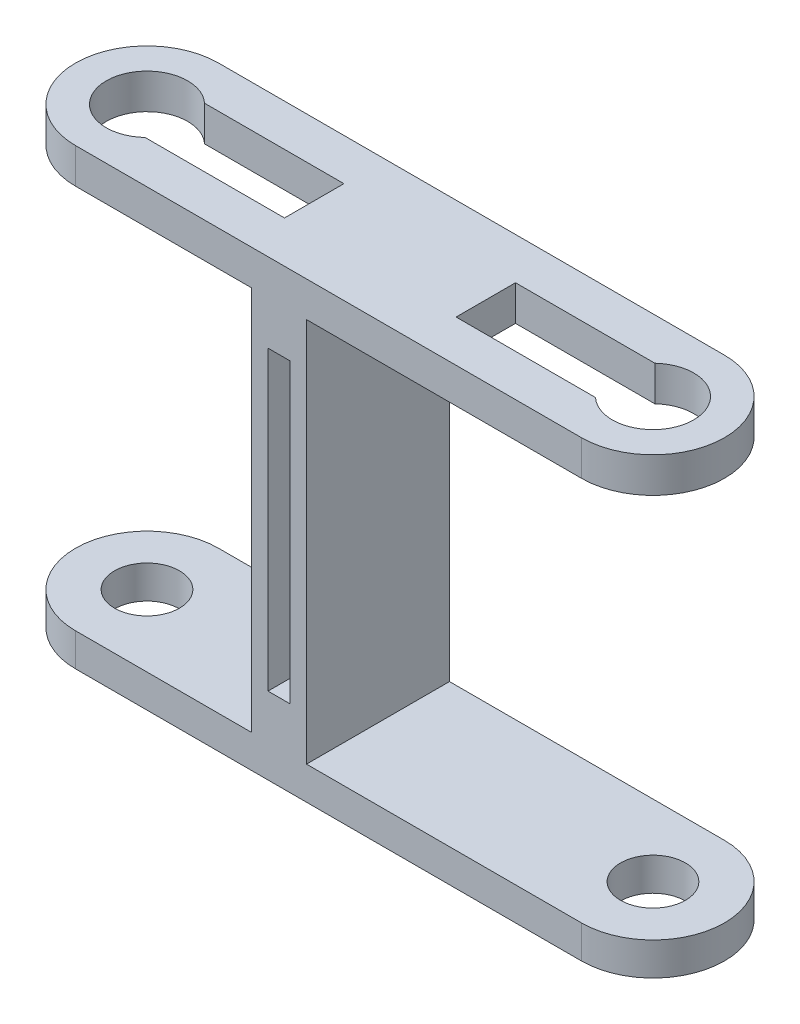
from build123d import *

# Parameters (mm, degrees)
BOSS_EXTRUDE1_START   = 43.1
SKETCH1_R             = 6.5
BOSS_EXTRUDE1_DEPTH   = 1.6
BOSS_EXTRUDE1_2_DEPTH = 1.6
BOSS_EXTRUDE2_START   = 43.1
SKETCH2_W             = 46
SKETCH2_H             = 13
BOSS_EXTRUDE2_DEPTH   = 1.6
CUT_EXTRUDE1_START    = 43.1
SKETCH3_R             = 3.7
CUT_EXTRUDE1_DEPTH    = 1.6
CUT_EXTRUDE2_START    = 43.1
SKETCH4_W             = 15.2
SKETCH4_H             = 5.4
CUT_EXTRUDE2_DEPTH    = 1.6
BOSS_EXTRUDE3_START   = 5
SKETCH5_R             = 6.5
BOSS_EXTRUDE3_DEPTH   = 1.5
BOSS_EXTRUDE3_2_DEPTH = 1.5
BOSS_EXTRUDE4_START   = 5
SKETCH6_W             = 46
SKETCH6_H             = 13
BOSS_EXTRUDE4_DEPTH   = 1.5
CUT_EXTRUDE3_START    = 5
SKETCH7_R             = 2.95
CUT_EXTRUDE3_DEPTH    = 1.5
BOSS_EXTRUDE5_START   = 18.5
SKETCH8_W             = 13
SKETCH8_H             = 41.2
BOSS_EXTRUDE5_DEPTH   = 2.5
CUT_EXTRUDE4_START    = -0.01
SKETCH9_W             = 2
SKETCH9_H             = 27
CUT_EXTRUDE4_DEPTH    = 6.51


with BuildPart() as part:
    # Sketch1 → Boss-Extrude1 (new, symmetric)
    with BuildSketch(Plane(origin=(0, 0, 0), x_dir=(1, 0, 0), z_dir=(0, 1, 0)).offset(BOSS_EXTRUDE1_START)):
        with Locations(Location((0, 0, 0), (0, 0, 270))):
            Circle(SKETCH1_R)
    extrude(amount=BOSS_EXTRUDE1_DEPTH, both=True)



with BuildPart() as body_2:
    # Sketch1 → Boss-Extrude1 2 (new, symmetric)
    with BuildSketch(Plane(origin=(0, 0, 0), x_dir=(1, 0, 0), z_dir=(0, 1, 0)).offset(BOSS_EXTRUDE1_START)):
        with Locations(Location((46, 0, 0), (0, 0, 270))):
            Circle(SKETCH1_R)
    extrude(amount=BOSS_EXTRUDE1_2_DEPTH, both=True)


with BuildPart() as part_1:
    add(part.part)

    add(body_2.part)  # Boss-Extrude2 merges body 2
    # Sketch2 → Boss-Extrude2 (add, symmetric)
    with BuildSketch(Plane(origin=(0, 0, 0), x_dir=(1, 0, 0), z_dir=(0, 1, 0)).offset(BOSS_EXTRUDE2_START)):
        with Locations((23, 0)):
            Rectangle(SKETCH2_W, SKETCH2_H)
    extrude(amount=BOSS_EXTRUDE2_DEPTH, both=True)

    # Sketch3 → Cut-Extrude1 (cut, symmetric)
    with BuildSketch(Plane(origin=(0, 0, 0), x_dir=(1, 0, 0), z_dir=(0, 1, 0)).offset(CUT_EXTRUDE1_START)):
        with Locations(Location((0, 0, 0), (0, 0, 270))):
            Circle(SKETCH3_R)
        with Locations(Location((46, 0, 0), (0, 0, 270))):
            Circle(SKETCH3_R)
    extrude(amount=CUT_EXTRUDE1_DEPTH, both=True, mode=Mode.SUBTRACT)

    # Sketch4 → Cut-Extrude2 (cut, symmetric)
    with BuildSketch(Plane(origin=(0, 0, 0), x_dir=(1, 0, 0), z_dir=(0, 1, 0)).offset(CUT_EXTRUDE2_START)):
        with Locations((7.6, 0)):
            Rectangle(SKETCH4_W, SKETCH4_H)
        with Locations((38.4, 0)):
            Rectangle(SKETCH4_W, SKETCH4_H)
    extrude(amount=CUT_EXTRUDE2_DEPTH, both=True, mode=Mode.SUBTRACT)



with BuildPart() as body_2_2:
    # Sketch5 → Boss-Extrude3 (new, symmetric)
    with BuildSketch(Plane(origin=(0, 0, 0), x_dir=(1, 0, 0), z_dir=(0, 1, 0)).offset(BOSS_EXTRUDE3_START)):
        with Locations(Location((0, 0, 0), (0, 0, 270))):
            Circle(SKETCH5_R)
    extrude(amount=BOSS_EXTRUDE3_DEPTH, both=True)



with BuildPart() as body_3:
    # Sketch5 → Boss-Extrude3 2 (new, symmetric)
    with BuildSketch(Plane(origin=(0, 0, 0), x_dir=(1, 0, 0), z_dir=(0, 1, 0)).offset(BOSS_EXTRUDE3_START)):
        with Locations(Location((46, 0, 0), (0, 0, 270))):
            Circle(SKETCH5_R)
    extrude(amount=BOSS_EXTRUDE3_2_DEPTH, both=True)


with BuildPart() as body_2_2_1:
    add(body_2_2.part)

    add(body_3.part)  # Boss-Extrude4 merges body 3
    # Sketch6 → Boss-Extrude4 (add, symmetric)
    with BuildSketch(Plane(origin=(0, 0, 0), x_dir=(1, 0, 0), z_dir=(0, 1, 0)).offset(BOSS_EXTRUDE4_START)):
        with Locations((23, 0)):
            Rectangle(SKETCH6_W, SKETCH6_H)
    extrude(amount=BOSS_EXTRUDE4_DEPTH, both=True)

    # Sketch7 → Cut-Extrude3 (cut, symmetric)
    with BuildSketch(Plane(origin=(0, 0, 0), x_dir=(1, 0, 0), z_dir=(0, 1, 0)).offset(CUT_EXTRUDE3_START)):
        with Locations(Location((0, 0, 0), (0, 0, 270))):
            Circle(SKETCH7_R)
        with Locations(Location((46, 0, 0), (0, 0, 270))):
            Circle(SKETCH7_R)
    extrude(amount=CUT_EXTRUDE3_DEPTH, both=True, mode=Mode.SUBTRACT)


with BuildPart() as part_2:
    add(part_1.part)

    add(body_2_2_1.part)  # Boss-Extrude5 merges body 2 2
    # Sketch8 → Boss-Extrude5 (add, symmetric)
    with BuildSketch(Plane(origin=(0, 0, 0), x_dir=(0, 0, -1), z_dir=(1, 0, 0)).offset(BOSS_EXTRUDE5_START)):
        with Locations((0, 24.1)):
            Rectangle(SKETCH8_W, SKETCH8_H)
    extrude(amount=BOSS_EXTRUDE5_DEPTH, both=True)

    # Sketch9 → Cut-Extrude4 (cut, symmetric)
    with BuildSketch(Plane.XY.offset(CUT_EXTRUDE4_START)):
        with Locations((18.5, 24)):
            Rectangle(SKETCH9_W, SKETCH9_H)
    extrude(amount=CUT_EXTRUDE4_DEPTH, both=True, mode=Mode.SUBTRACT)


solid = part_2.part
